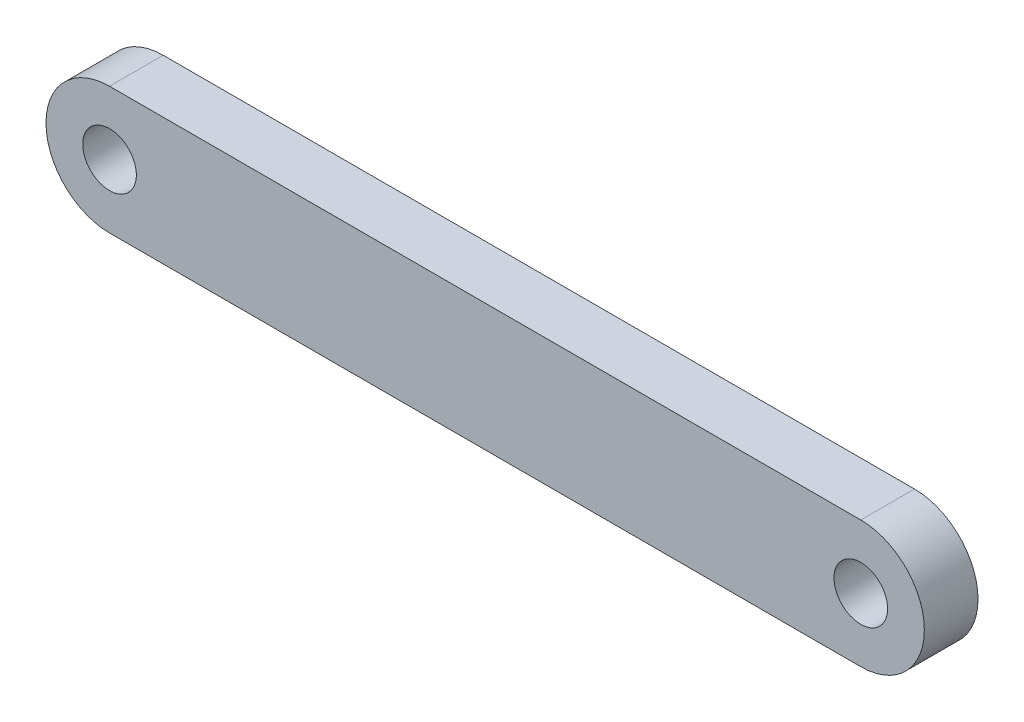
from build123d import *

# Parameters (mm, degrees)
SKETCH1_R           = 1
BOSS_EXTRUDE1_DEPTH = 2


with BuildPart() as part:
    # Sketch1 → Boss-Extrude1 (new body)
    with BuildSketch(Plane.XY):
        with BuildLine():
            Line((-13.894736842, 2.368421053), (14.105263158, 2.368421053))
            ThreePointArc((14.105263158, 2.368421053), (16.473684211, 0), (14.105263158, -2.368421053))
            Line((14.105263158, -2.368421053), (-13.894736842, -2.368421053))
            ThreePointArc((-13.894736842, -2.368421053), (-16.263157895, 0), (-13.894736842, 2.368421053))
        make_face()
        with Locations((14.105263158, 0)):
            Circle(SKETCH1_R, mode=Mode.SUBTRACT)
        with Locations((-13.894736842, 0)):
            Circle(SKETCH1_R, mode=Mode.SUBTRACT)
    extrude(amount=BOSS_EXTRUDE1_DEPTH)


solid = part.part
